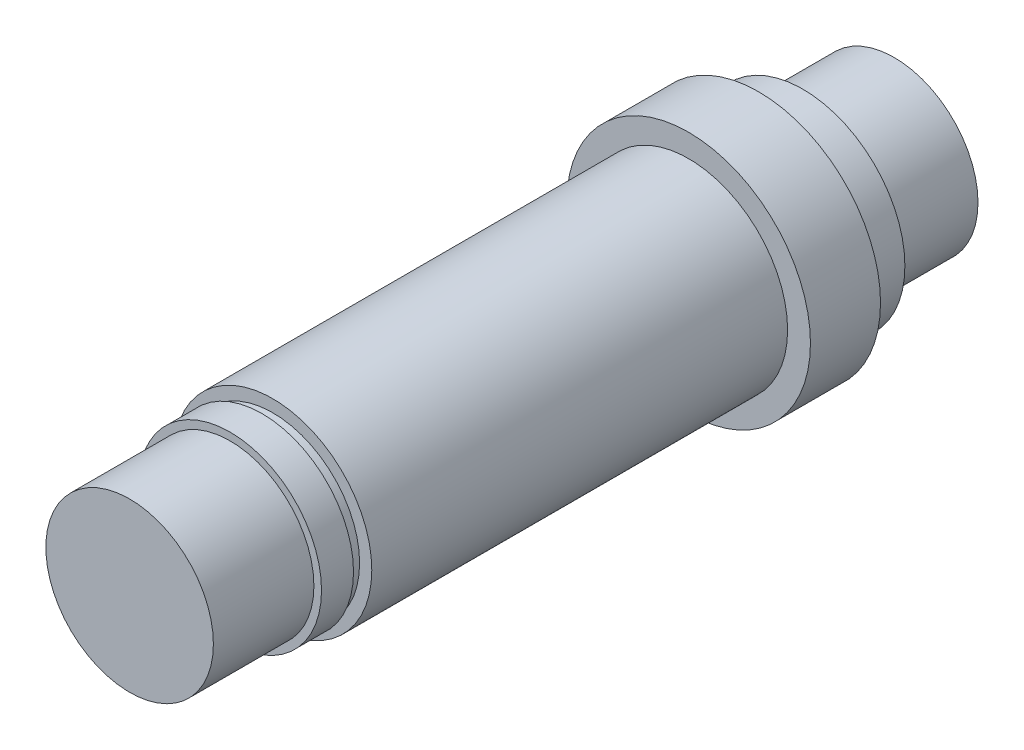
from build123d import *


with BuildPart() as part:
    # 草图1 → 旋转2 (revolve)
    with BuildSketch(Plane(origin=(0, 0, 0), x_dir=(0, 0, -1), z_dir=(1, 0, 0)), mode=Mode.PRIVATE) as revolve_2_sk:
        Polygon((0, 0), (251, 0), (251, 27.5), (221, 27.5), (221, 33.5), (206.5, 33.5), (206.5, 40), (183.5, 40), (183.5, 32.5), (47, 32.5), (47, 28.5), (43.5, 28.5), (43.5, 30), (33, 30), (33, 27.5), (0, 27.5), align=None)
    revolve(revolve_2_sk.sketch.rotate(Axis((0, 0, 1000), (0, 0, -1)), 90), axis=Axis((0, 0, 1000), (0, 0, -1)))


solid = part.part
